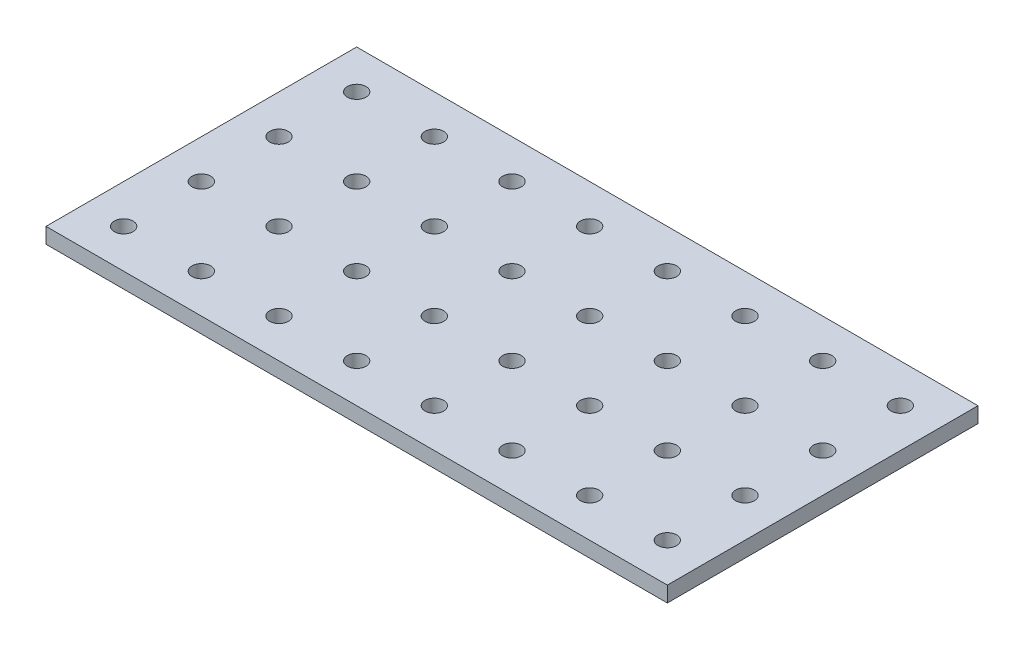
from build123d import *

# Parameters (mm, degrees)
SKETCH_1_W      = 200
SKETCH_1_H      = 100
SKETCH_1_R      = 3
EXTRUDE_1_DEPTH = 5


with BuildPart() as part:
    # 草图1 → 凸台-拉伸1 (new body)
    with BuildSketch(Plane(origin=(0, 0, 0), x_dir=(1, 0, 0), z_dir=(0, 1, 0))):
        with Locations((-3.910614525, -3.910614525)):
            Rectangle(SKETCH_1_W, SKETCH_1_H)
        with Locations(Location((-91.410614525, -41.410614525, 0), (0, 0, 270))):
            Circle(SKETCH_1_R, mode=Mode.SUBTRACT)
        with Locations(Location((-66.410614525, -41.410614525, 0), (0, 0, 270))):
            Circle(SKETCH_1_R, mode=Mode.SUBTRACT)
        with Locations(Location((-41.410614525, -41.410614525, 0), (0, 0, 270))):
            Circle(SKETCH_1_R, mode=Mode.SUBTRACT)
        with Locations(Location((-16.410614525, -41.410614525, 0), (0, 0, 270))):
            Circle(SKETCH_1_R, mode=Mode.SUBTRACT)
        with Locations(Location((8.589385475, -41.410614525, 0), (0, 0, 270))):
            Circle(SKETCH_1_R, mode=Mode.SUBTRACT)
        with Locations(Location((33.589385475, -41.410614525, 0), (0, 0, 270))):
            Circle(SKETCH_1_R, mode=Mode.SUBTRACT)
        with Locations(Location((58.589385475, -41.410614525, 0), (0, 0, 270))):
            Circle(SKETCH_1_R, mode=Mode.SUBTRACT)
        with Locations(Location((83.589385475, -41.410614525, 0), (0, 0, 270))):
            Circle(SKETCH_1_R, mode=Mode.SUBTRACT)
        with Locations(Location((-66.410614525, -16.410614525, 0), (0, 0, 270))):
            Circle(SKETCH_1_R, mode=Mode.SUBTRACT)
        with Locations(Location((-41.410614525, -16.410614525, 0), (0, 0, 270))):
            Circle(SKETCH_1_R, mode=Mode.SUBTRACT)
        with Locations(Location((-16.410614525, -16.410614525, 0), (0, 0, 270))):
            Circle(SKETCH_1_R, mode=Mode.SUBTRACT)
        with Locations(Location((8.589385475, -16.410614525, 0), (0, 0, 270))):
            Circle(SKETCH_1_R, mode=Mode.SUBTRACT)
        with Locations(Location((33.589385475, -16.410614525, 0), (0, 0, 270))):
            Circle(SKETCH_1_R, mode=Mode.SUBTRACT)
        with Locations(Location((58.589385475, -16.410614525, 0), (0, 0, 270))):
            Circle(SKETCH_1_R, mode=Mode.SUBTRACT)
        with Locations(Location((83.589385475, -16.410614525, 0), (0, 0, 270))):
            Circle(SKETCH_1_R, mode=Mode.SUBTRACT)
        with Locations(Location((-66.410614525, 8.589385475, 0), (0, 0, 270))):
            Circle(SKETCH_1_R, mode=Mode.SUBTRACT)
        with Locations(Location((-41.410614525, 8.589385475, 0), (0, 0, 270))):
            Circle(SKETCH_1_R, mode=Mode.SUBTRACT)
        with Locations(Location((-16.410614525, 8.589385475, 0), (0, 0, 270))):
            Circle(SKETCH_1_R, mode=Mode.SUBTRACT)
        with Locations(Location((8.589385475, 8.589385475, 0), (0, 0, 270))):
            Circle(SKETCH_1_R, mode=Mode.SUBTRACT)
        with Locations(Location((33.589385475, 8.589385475, 0), (0, 0, 270))):
            Circle(SKETCH_1_R, mode=Mode.SUBTRACT)
        with Locations(Location((58.589385475, 8.589385475, 0), (0, 0, 270))):
            Circle(SKETCH_1_R, mode=Mode.SUBTRACT)
        with Locations(Location((83.589385475, 8.589385475, 0), (0, 0, 270))):
            Circle(SKETCH_1_R, mode=Mode.SUBTRACT)
        with Locations(Location((-66.410614525, 33.589385475, 0), (0, 0, 270))):
            Circle(SKETCH_1_R, mode=Mode.SUBTRACT)
        with Locations(Location((-41.410614525, 33.589385475, 0), (0, 0, 270))):
            Circle(SKETCH_1_R, mode=Mode.SUBTRACT)
        with Locations(Location((-16.410614525, 33.589385475, 0), (0, 0, 270))):
            Circle(SKETCH_1_R, mode=Mode.SUBTRACT)
        with Locations(Location((8.589385475, 33.589385475, 0), (0, 0, 270))):
            Circle(SKETCH_1_R, mode=Mode.SUBTRACT)
        with Locations(Location((33.589385475, 33.589385475, 0), (0, 0, 270))):
            Circle(SKETCH_1_R, mode=Mode.SUBTRACT)
        with Locations(Location((58.589385475, 33.589385475, 0), (0, 0, 270))):
            Circle(SKETCH_1_R, mode=Mode.SUBTRACT)
        with Locations(Location((83.589385475, 33.589385475, 0), (0, 0, 270))):
            Circle(SKETCH_1_R, mode=Mode.SUBTRACT)
        with Locations(Location((-91.410614525, -16.410614525, 0), (0, 0, 270))):
            Circle(SKETCH_1_R, mode=Mode.SUBTRACT)
        with Locations(Location((-91.410614525, 8.589385475, 0), (0, 0, 270))):
            Circle(SKETCH_1_R, mode=Mode.SUBTRACT)
        with Locations(Location((-91.410614525, 33.589385475, 0), (0, 0, 270))):
            Circle(SKETCH_1_R, mode=Mode.SUBTRACT)
    extrude(amount=EXTRUDE_1_DEPTH)


solid = part.part
